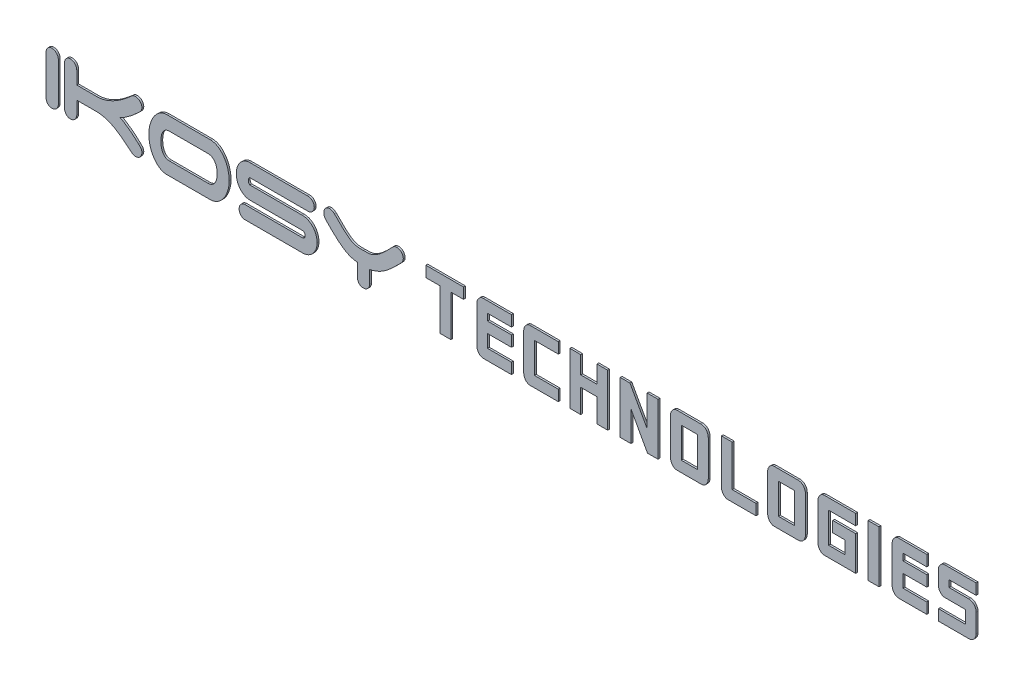
from build123d import *

# Parameters (mm, degrees)
TEXT_EXTRUDE_DEPTH    = 0.1
TEXT_EXTRUDE_2_DEPTH  = 0.1
TEXT_EXTRUDE_3_DEPTH  = 0.1
TEXT_EXTRUDE_4_DEPTH  = 0.1
TEXT_EXTRUDE_5_DEPTH  = 0.1
TEXT_EXTRUDE_6_DEPTH  = 0.1
TEXT_EXTRUDE_7_DEPTH  = 0.1
TEXT_EXTRUDE_8_DEPTH  = 0.1
TEXT_EXTRUDE_9_DEPTH  = 0.1
TEXT_EXTRUDE_10_DEPTH = 0.1
TEXT_SKETCH_W         = 0.872727273
TEXT_SKETCH_H         = 1.636363636
TEXT_EXTRUDE_11_DEPTH = 0.1
TEXT_EXTRUDE_12_DEPTH = 0.1
TEXT_SKETCH_W_2       = 0.872727272
TEXT_EXTRUDE_13_DEPTH = 0.1
TEXT_EXTRUDE_14_DEPTH = 0.1
TEXT_SKETCH_W_3       = 0.581818182
TEXT_SKETCH_H_2       = 2.8
TEXT_EXTRUDE_15_DEPTH = 0.1
TEXT_EXTRUDE_16_DEPTH = 0.1
TEXT_EXTRUDE_17_DEPTH = 0.1


with BuildPart() as part:
    # Text Sketch → Text Extrude (new body)
    with BuildSketch(Plane.XY):
        with BuildLine():
            add(Edge.make_bspline(
                [(0.770025924, 0.402981205), (0.769100464, 0.38197876), (0.767227902, 0.339482682), (0.747819923, 0.277513771), (0.717935584, 0.2173944), (0.678368994, 0.160054086), (0.626661606, 0.110313992), (0.562978058, 0.073883082), (0.488810615, 0.053108974), (0.436262188, 0.050488838), (0.408911212, 0.049125081)],
                knots=[0, 0, 0, 0, 0.891768742, 1.804393405, 2.73723021, 3.744576, 4.755535893, 5.764854616, 6.836627258, 8, 8, 8, 8], degree=3))
            add(Edge.make_bspline(
                [(0.408911212, 0.049125081), (0.38787013, 0.050203738), (0.346583857, 0.052320251), (0.288069812, 0.073334095), (0.235824177, 0.107352883), (0.190290246, 0.152672498), (0.152042241, 0.206458787), (0.125874933, 0.267854818), (0.108750946, 0.333700929), (0.106839806, 0.379583058), (0.105865198, 0.402981205)],
                knots=[0, 0, 0, 0, 0.9719281, 1.907092461, 2.840049136, 3.840945847, 4.867320657, 5.877591824, 6.917652236, 8, 8, 8, 8], degree=3))
            Line((0.105865198, 0.402981205), (0.105865198, 2.495268957))
            add(Edge.make_bspline(
                [(0.105865198, 2.495268957), (0.106806368, 2.518676155), (0.108640119, 2.56428213), (0.126065524, 2.629728186), (0.151970753, 2.690948813), (0.190627202, 2.744614247), (0.235577774, 2.791280862), (0.288659008, 2.82439188), (0.346792462, 2.846121687), (0.387843823, 2.848106489), (0.408911212, 2.849125081)],
                knots=[0, 0, 0, 0, 1.083042246, 2.110171353, 3.121090755, 4.148124132, 5.159529717, 6.104911255, 7.027448268, 8, 8, 8, 8], degree=3))
            add(Edge.make_bspline(
                [(0.408911212, 2.849125081), (0.436279932, 2.847806262), (0.48857148, 2.845286485), (0.562234552, 2.824094355), (0.626209705, 2.788085686), (0.676690967, 2.737031565), (0.718672215, 2.680937653), (0.747298742, 2.620189553), (0.767398885, 2.558538665), (0.769153021, 2.51629198), (0.770025924, 2.495268957)],
                knots=[0, 0, 0, 0, 1.164422676, 2.224783052, 3.235012677, 4.25579094, 5.261076507, 6.20633436, 7.107426445, 8, 8, 8, 8], degree=3))
            Line((0.770025924, 2.495268957), (0.770025924, 0.402981205))
        make_face()
    extrude(amount=TEXT_EXTRUDE_DEPTH)


with BuildPart() as body_2:
    # Text Sketch → Text Extrude 2 (new body)
    with BuildSketch(Plane.XY):
        with BuildLine():
            Line((1.763690214, 1.802981205), (2.827980557, 1.802981205))
            add(Edge.make_bspline(
                [(2.827980557, 1.802981205), (2.870657077, 1.804199673), (2.955944714, 1.806634741), (3.083232823, 1.820995082), (3.208884933, 1.847082013), (3.375712721, 1.893293848), (3.581242747, 1.973756548), (3.822298654, 2.093163456), (4.055077222, 2.236888499), (4.278204959, 2.398034905), (4.491821207, 2.56928233), (4.629652171, 2.687832831), (4.697974076, 2.746597537)],
                knots=[0, 0, 0, 0, 0.598390986, 1.195864919, 1.79291744, 2.395738573, 3.621030924, 4.880124848, 6.162898607, 7.451335977, 8.736643965, 10, 10, 10, 10], degree=3))
            add(Edge.make_bspline(
                [(4.697974076, 2.746597537), (4.715106529, 2.761926842), (4.747642249, 2.791038257), (4.800899855, 2.825038148), (4.856270743, 2.845150532), (4.893810991, 2.847822951), (4.912102398, 2.849125081)],
                knots=[0, 0, 0, 0, 1.132539444, 2.150771204, 3.098967176, 4, 4, 4, 4], degree=3))
            add(Edge.make_bspline(
                [(4.912102398, 2.849125081), (4.939480214, 2.847822491), (4.991789141, 2.845333721), (5.065587232, 2.823854142), (5.130190116, 2.788398085), (5.180771503, 2.736998815), (5.222775198, 2.680945804), (5.25139615, 2.620187546), (5.271497661, 2.558539151), (5.273251619, 2.516292141), (5.274124433, 2.495268957)],
                knots=[0, 0, 0, 0, 1.162794875, 2.221672924, 3.241673875, 4.261025145, 5.264905377, 6.208841809, 7.108674215, 8, 8, 8, 8], degree=3))
            add(Edge.make_bspline(
                [(5.274124433, 2.495268957), (5.271909873, 2.466737651), (5.267499542, 2.409917117), (5.229293815, 2.329927891), (5.171281497, 2.25593042), (5.123032849, 2.2114858), (5.097196371, 2.187686325)],
                knots=[0, 0, 0, 0, 0.930691466, 1.853486366, 2.850571857, 4, 4, 4, 4], degree=3))
            add(Edge.make_bspline(
                [(5.097196371, 2.187686325), (5.054627056, 2.148591015), (4.973562424, 2.074141921), (4.854319958, 1.966994095), (4.73594283, 1.86754386), (4.613852942, 1.770000128), (4.481596275, 1.674615553), (4.367758709, 1.595819699), (4.275168158, 1.53875346), (4.213015208, 1.500765845), (4.156371355, 1.471603622), (4.120379776, 1.455630408), (4.103677252, 1.448217758)],
                knots=[0, 0, 0, 0, 1.394680526, 2.655886419, 3.867820071, 5.124965461, 6.425567842, 7.801989833, 8.464170533, 9.049914496, 9.559096148, 10, 10, 10, 10], degree=3))
            add(Edge.make_bspline(
                [(4.103677252, 1.448217758), (4.122220662, 1.43994625), (4.161030335, 1.422634736), (4.220293441, 1.391245415), (4.283329446, 1.354418667), (4.371170374, 1.296747291), (4.482970734, 1.223246439), (4.611163243, 1.128009302), (4.735126151, 1.032852325), (4.852698401, 0.931021732), (4.973628723, 0.824530793), (5.054707125, 0.749751845), (5.097196371, 0.710563837)],
                knots=[0, 0, 0, 0, 0.490243261, 1.026034652, 1.618564429, 2.252714874, 3.56340164, 4.848998911, 6.108435473, 7.336408224, 8.604141129, 10, 10, 10, 10], degree=3))
            add(Edge.make_bspline(
                [(5.097196371, 0.710563837), (5.123634748, 0.685842427), (5.172330155, 0.64030941), (5.230449706, 0.566365026), (5.268868825, 0.487505583), (5.272348512, 0.431542815), (5.274124433, 0.402981205)],
                knots=[0, 0, 0, 0, 1.183672799, 2.180142437, 3.071202806, 4, 4, 4, 4], degree=3))
            add(Edge.make_bspline(
                [(5.274124433, 0.402981205), (5.273202889, 0.381975965), (5.271338248, 0.339474231), (5.251869344, 0.27754882), (5.222151445, 0.217097592), (5.181456291, 0.160341595), (5.129914401, 0.110270058), (5.066151734, 0.073895569), (4.992006736, 0.053105455), (4.939455063, 0.050487633), (4.912102398, 0.049125081)],
                knots=[0, 0, 0, 0, 0.890937897, 1.802712285, 2.734679982, 3.748540701, 4.758558701, 5.766937061, 6.837711151, 8, 8, 8, 8], degree=3))
            add(Edge.make_bspline(
                [(4.912102398, 0.049125081), (4.893445149, 0.050255128), (4.854978495, 0.052585006), (4.798987207, 0.075909014), (4.74263208, 0.109405827), (4.709220907, 0.140643357), (4.691622813, 0.157096565)],
                knots=[0, 0, 0, 0, 0.885578475, 1.825844712, 2.854844459, 4, 4, 4, 4], degree=3))
            add(Edge.make_bspline(
                [(4.691622813, 0.157096565), (4.623932405, 0.215592505), (4.48654833, 0.334315539), (4.272806227, 0.505291708), (4.051050671, 0.667091645), (3.85768285, 0.786050426), (3.699658135, 0.870329142), (3.579224674, 0.926638139), (3.456350596, 0.975469998), (3.332441566, 1.018319367), (3.207201551, 1.053430798), (3.080890108, 1.077293003), (2.95454637, 1.094039499), (2.870073751, 1.095465631), (2.827980557, 1.09617628)],
                knots=[0, 0, 0, 0, 1.509831065, 3.064344723, 4.618430907, 6.139977425, 6.891238491, 7.640276577, 8.382465372, 9.121787443, 9.852424025, 10.575208506, 11.29001819, 12, 12, 12, 12], degree=3))
            Line((2.827980557, 1.09617628), (1.763690214, 1.09617628))
            Line((1.763690214, 1.09617628), (1.763690214, 0.402981205))
            add(Edge.make_bspline(
                [(1.763690214, 0.402981205), (1.762768593, 0.381976068), (1.760903796, 0.339474542), (1.741436088, 0.277547528), (1.711713391, 0.21710274), (1.671037755, 0.160320538), (1.619611699, 0.110531595), (1.557178236, 0.074277219), (1.484982519, 0.052942734), (1.43387676, 0.050437237), (1.407112119, 0.049125081)],
                knots=[0, 0, 0, 0, 0.899232803, 1.819496092, 2.760140696, 3.78344077, 4.80286235, 5.809387238, 6.85275233, 8, 8, 8, 8], degree=3))
            add(Edge.make_bspline(
                [(1.407112119, 0.049125081), (1.386071037, 0.050203738), (1.344784764, 0.052320251), (1.28627072, 0.073334095), (1.234025084, 0.107352883), (1.188491154, 0.152672498), (1.150243149, 0.206458787), (1.12407584, 0.267854818), (1.106951853, 0.333700929), (1.105040714, 0.379583058), (1.104066105, 0.402981205)],
                knots=[0, 0, 0, 0, 0.9719281, 1.907092461, 2.840049136, 3.840945847, 4.867320657, 5.877591824, 6.917652236, 8, 8, 8, 8], degree=3))
            Line((1.104066105, 0.402981205), (1.104066105, 2.495268957))
            add(Edge.make_bspline(
                [(1.104066105, 2.495268957), (1.105007602, 2.518675656), (1.106841991, 2.564280659), (1.124262827, 2.629733683), (1.150185052, 2.690928392), (1.18877752, 2.744691389), (1.233601878, 2.790639584), (1.285112724, 2.824653513), (1.341706068, 2.845858413), (1.381526624, 2.848027792), (1.401668179, 2.849125081)],
                knots=[0, 0, 0, 0, 1.093794082, 2.131119951, 3.152075194, 4.189304383, 5.210750635, 6.141692323, 7.060053139, 8, 8, 8, 8], degree=3))
            add(Edge.make_bspline(
                [(1.401668179, 2.849125081), (1.429045995, 2.847822491), (1.481354922, 2.845333721), (1.555153013, 2.823854142), (1.619755897, 2.788398085), (1.670337284, 2.736998815), (1.712340979, 2.680945804), (1.740961931, 2.620187546), (1.761063442, 2.558539151), (1.7628174, 2.516292141), (1.763690214, 2.495268957)],
                knots=[0, 0, 0, 0, 1.162794875, 2.221672924, 3.241673875, 4.261025145, 5.264905377, 6.208841809, 7.108674215, 8, 8, 8, 8], degree=3))
            Line((1.763690214, 2.495268957), (1.763690214, 1.802981205))
        make_face()
    extrude(amount=TEXT_EXTRUDE_2_DEPTH)


with BuildPart() as body_3:
    # Text Sketch → Text Extrude 3 (new body)
    with BuildSketch(Plane.XY):
        with BuildLine():
            add(Edge.make_bspline(
                [(9.977834089, 1.449125081), (9.976768994, 1.410693114), (9.974609055, 1.332755732), (9.962971788, 1.215011152), (9.941470153, 1.095428473), (9.912817637, 0.975434572), (9.87719651, 0.856860297), (9.83244172, 0.743285713), (9.780589543, 0.635049574), (9.721917238, 0.531794432), (9.653621978, 0.43566543), (9.576838076, 0.345708882), (9.490544852, 0.263320687), (9.395840144, 0.188502711), (9.291422378, 0.125804716), (9.176256373, 0.080890731), (9.051758956, 0.054299041), (8.965693599, 0.050874965), (8.921709657, 0.049125081)],
                knots=[0, 0, 0, 0, 0.951147274, 1.928861125, 2.924201554, 3.955194829, 4.980222808, 5.984971413, 6.972403223, 7.947966706, 8.919705167, 9.885634216, 10.870112358, 11.867111244, 12.866914791, 13.871663396, 14.912307617, 16, 16, 16, 16], degree=3))
            Line((8.921709657, 0.049125081), (6.589888529, 0.049125081))
            add(Edge.make_bspline(
                [(6.589888529, 0.049125081), (6.552500658, 0.052855716), (6.479131709, 0.060176615), (6.373238223, 0.090109028), (6.274157022, 0.134652098), (6.183449888, 0.195498039), (6.10038554, 0.267754573), (6.023221857, 0.34782968), (5.951884602, 0.435130995), (5.8885166, 0.530774813), (5.832472362, 0.633249702), (5.783805796, 0.74151249), (5.740735087, 0.854325028), (5.705556648, 0.971682517), (5.678980286, 1.091606827), (5.658673805, 1.211466461), (5.646414023, 1.330612003), (5.645107074, 1.409780238), (5.64445755, 1.449125081)],
                knots=[0, 0, 0, 0, 0.975181915, 1.913670687, 2.84608033, 3.788086209, 4.741473597, 5.703381033, 6.675865344, 7.668013681, 8.681367061, 9.708774433, 10.751351276, 11.818422699, 12.890348938, 13.9424572, 14.977447237, 16, 16, 16, 16], degree=3))
            add(Edge.make_bspline(
                [(5.64445755, 1.449125081), (5.645495707, 1.489674778), (5.647576169, 1.570936218), (5.659338805, 1.693199019), (5.680567048, 1.815551665), (5.709183039, 1.937515995), (5.746498326, 2.056836595), (5.790228883, 2.171801317), (5.842869418, 2.280618605), (5.901159881, 2.384122363), (5.968046634, 2.48061485), (6.044007117, 2.567646161), (6.126086355, 2.647467166), (6.215238893, 2.718375165), (6.312221834, 2.777211779), (6.416601715, 2.819261995), (6.527577539, 2.844715931), (6.603664886, 2.847634784), (6.642513286, 2.849125081)],
                knots=[0, 0, 0, 0, 1.027412279, 2.058930345, 3.10819438, 4.171215559, 5.230253093, 6.273232037, 7.284199589, 8.289664721, 9.280159167, 10.252499264, 11.211587296, 12.177263302, 13.132548821, 14.074435823, 15.016852456, 16, 16, 16, 16], degree=3))
            Line((6.642513286, 2.849125081), (8.975241737, 2.848217758))
            add(Edge.make_bspline(
                [(8.975241737, 2.848217758), (9.018088978, 2.844358502), (9.101553319, 2.836840859), (9.22091963, 2.804313656), (9.330210435, 2.756006869), (9.428627689, 2.691520227), (9.516522346, 2.615509198), (9.59823537, 2.534085314), (9.670026252, 2.444056529), (9.734355269, 2.348140785), (9.790715807, 2.245953078), (9.839530262, 2.138360871), (9.882543536, 2.026188691), (9.916361269, 1.909447309), (9.943190646, 1.791820676), (9.963459914, 1.675591853), (9.975862664, 1.561603885), (9.977181559, 1.486354907), (9.977834089, 1.449125081)],
                knots=[0, 0, 0, 0, 1.091442399, 2.126076716, 3.127202836, 4.1162807, 5.103236494, 6.075967326, 7.043340396, 8.023812075, 9.007621206, 10.004905352, 11.024010646, 12.057502667, 13.090308704, 14.088421602, 15.054236585, 16, 16, 16, 16], degree=3))
        make_face()
        with BuildLine():
            add(Edge.make_bspline(
                [(8.813738172, 0.755930006), (8.838912426, 0.756747149), (8.886888002, 0.758304409), (8.955180633, 0.771516297), (9.016797932, 0.791434255), (9.08660697, 0.83260366), (9.161351282, 0.89657875), (9.230746739, 0.991778059), (9.279799102, 1.10145625), (9.308259352, 1.220132072), (9.324261497, 1.337078989), (9.326937626, 1.413395263), (9.328190538, 1.449125081)],
                knots=[0, 0, 0, 0, 0.775634069, 1.478156669, 2.138937624, 2.761407784, 3.965416657, 5.146404436, 6.36538836, 7.645919842, 8.897864736, 10, 10, 10, 10], degree=3))
            add(Edge.make_bspline(
                [(9.328190538, 1.449125081), (9.326940513, 1.484856276), (9.324270552, 1.561175491), (9.308216911, 1.678097852), (9.280022246, 1.79660109), (9.230445434, 1.905711034), (9.161363829, 2.001078623), (9.085874058, 2.064682084), (9.015723794, 2.105705074), (8.954475669, 2.12701859), (8.88624899, 2.139801106), (8.838598359, 2.141456504), (8.813738172, 2.142320156)],
                knots=[0, 0, 0, 0, 1.102975105, 2.355873999, 3.637381263, 4.848799325, 6.030687032, 7.242716405, 7.865660895, 8.530035044, 9.233092976, 10, 10, 10, 10], degree=3))
            Line((8.813738172, 2.142320156), (6.749577447, 2.142320156))
            add(Edge.make_bspline(
                [(6.749577447, 2.142320156), (6.729259059, 2.141685861), (6.690120803, 2.140464051), (6.63415291, 2.129383852), (6.583434803, 2.111379464), (6.523622383, 2.076708438), (6.457481335, 2.016381646), (6.394321307, 1.923909103), (6.343853297, 1.814200448), (6.313746735, 1.692157678), (6.296764897, 1.569082951), (6.294347675, 1.487885768), (6.293193778, 1.449125081)],
                knots=[0, 0, 0, 0, 0.656485055, 1.26455312, 1.836963808, 2.388955021, 3.490378164, 4.697909542, 5.989021309, 7.374490996, 8.746674077, 10, 10, 10, 10], degree=3))
            add(Edge.make_bspline(
                [(6.293193778, 1.449125081), (6.294331154, 1.41036199), (6.296713767, 1.329159771), (6.313964449, 1.206200956), (6.343040805, 1.083806782), (6.392721388, 0.973350736), (6.458188795, 0.882073848), (6.523389634, 0.820787026), (6.583269628, 0.785755928), (6.634355384, 0.769148338), (6.690091911, 0.757701387), (6.729249186, 0.756535348), (6.749577447, 0.755930006)],
                knots=[0, 0, 0, 0, 1.252397314, 2.623563721, 4.005555294, 5.304601695, 6.508940413, 7.616080884, 8.167663118, 8.736383808, 9.344001345, 10, 10, 10, 10], degree=3))
            Line((6.749577447, 0.755930006), (8.813738172, 0.755930006))
        make_face(mode=Mode.SUBTRACT)
    extrude(amount=TEXT_EXTRUDE_3_DEPTH)


with BuildPart() as body_4:
    # Text Sketch → Text Extrude 4 (new body)
    with BuildSketch(Plane.XY):
        with BuildLine():
            add(Edge.make_bspline(
                [(11.096709008, 1.09617628), (11.070628979, 1.096985745), (11.019311932, 1.09857851), (10.944209415, 1.113085503), (10.871789321, 1.134515488), (10.803063834, 1.16590159), (10.737747301, 1.203569096), (10.677691213, 1.248941867), (10.620944537, 1.298711625), (10.569259265, 1.355005558), (10.523229084, 1.417176508), (10.480900088, 1.483510377), (10.445148969, 1.555212288), (10.413869019, 1.630810659), (10.389149182, 1.710927181), (10.372599134, 1.795206955), (10.36095904, 1.882808223), (10.359696863, 1.942367025), (10.359055087, 1.97265068)],
                knots=[0, 0, 0, 0, 0.983596924, 1.935399995, 2.878119717, 3.828757832, 4.780492416, 5.719054283, 6.665362703, 7.626977031, 8.597497885, 9.582684033, 10.593731797, 11.61784737, 12.668851806, 13.752649796, 14.857297694, 16, 16, 16, 16], degree=3))
            add(Edge.make_bspline(
                [(10.359055087, 1.97265068), (10.359683542, 2.002936111), (10.360913292, 2.06219815), (10.372613648, 2.149185761), (10.389094597, 2.232596245), (10.41414614, 2.311960919), (10.444833549, 2.387692173), (10.48223479, 2.458471572), (10.52287105, 2.52605734), (10.570599551, 2.587300335), (10.62175593, 2.644787317), (10.678348818, 2.695436022), (10.738647593, 2.740864498), (10.804199369, 2.778285022), (10.872456751, 2.811015093), (10.945148926, 2.832145217), (11.019913115, 2.846682529), (11.070930108, 2.848305163), (11.096709008, 2.849125081)],
                knots=[0, 0, 0, 0, 1.143988435, 2.238538075, 3.312358927, 4.353623736, 5.378891967, 6.396292345, 7.376541077, 8.355055443, 9.326197841, 10.281195237, 11.22081347, 12.173619245, 13.130052163, 14.07383293, 15.02670727, 16, 16, 16, 16], degree=3))
            Line((11.096709008, 2.849125081), (14.197940376, 2.849125081))
            add(Edge.make_bspline(
                [(14.197940376, 2.849125081), (14.225318192, 2.847822491), (14.277627119, 2.845333721), (14.35142521, 2.823854142), (14.416028094, 2.788398085), (14.466609481, 2.736998815), (14.508613176, 2.680945804), (14.537234128, 2.620187546), (14.557335639, 2.558539151), (14.559089597, 2.516292141), (14.559962411, 2.495268957)],
                knots=[0, 0, 0, 0, 1.162794875, 2.221672924, 3.241673875, 4.261025145, 5.264905377, 6.208841809, 7.108674215, 8, 8, 8, 8], degree=3))
            add(Edge.make_bspline(
                [(14.559962411, 2.495268957), (14.55908865, 2.474246844), (14.557332788, 2.432001987), (14.537245896, 2.370337057), (14.508565383, 2.309646164), (14.466926676, 2.253490744), (14.415803347, 2.203431399), (14.351975225, 2.167100231), (14.277848797, 2.146297827), (14.225294439, 2.143681783), (14.197940376, 2.142320156)],
                knots=[0, 0, 0, 0, 0.892186174, 1.792887181, 2.737734788, 3.742584057, 4.754017175, 5.763808356, 6.836082689, 8, 8, 8, 8], degree=3))
            Line((14.197940376, 2.142320156), (11.085821128, 2.142320156))
            add(Edge.make_bspline(
                [(11.085821128, 2.142320156), (11.080881315, 2.139118825), (11.064606541, 2.128571677), (11.045471723, 2.107020748), (11.025860023, 2.080289984), (11.015692428, 2.049772452), (11.00807166, 2.013564784), (11.007889094, 1.986920718), (11.007791316, 1.97265068)],
                knots=[0, 0, 0, 0, 0.538815641, 1.775189386, 2.614152017, 3.562550695, 4.694550051, 6, 6, 6, 6], degree=3))
            add(Edge.make_bspline(
                [(11.007791316, 1.97265068), (11.007902671, 1.958987286), (11.008112447, 1.933247638), (11.015777271, 1.89794097), (11.026094047, 1.867596333), (11.045544192, 1.839663911), (11.064990168, 1.817538744), (11.081202387, 1.806208973), (11.085821128, 1.802981205)],
                knots=[0, 0, 0, 0, 1.254786338, 2.363816585, 3.315845588, 4.181196817, 5.481836512, 6, 6, 6, 6], degree=3))
            Line((11.085821128, 1.802981205), (13.912133506, 1.802981205))
            add(Edge.make_bspline(
                [(13.912133506, 1.802981205), (13.942161921, 1.802341305), (14.0011278, 1.801084751), (14.087355454, 1.78420387), (14.17047029, 1.760767806), (14.248278281, 1.724371845), (14.321036634, 1.681886546), (14.389177054, 1.635122069), (14.448812276, 1.580867085), (14.502947909, 1.522827162), (14.549655459, 1.459367173), (14.593338255, 1.393666562), (14.628106209, 1.321700073), (14.659125116, 1.247095258), (14.683804021, 1.168840514), (14.700913798, 1.088017276), (14.711053732, 1.004794724), (14.712544805, 0.948612856), (14.713300065, 0.920155541)],
                knots=[0, 0, 0, 0, 1.085808164, 2.132168238, 3.171913903, 4.206279592, 5.232083903, 6.222782105, 7.192487131, 8.145971036, 9.092381708, 10.043408583, 10.998652613, 11.981141727, 12.968503725, 13.965359516, 14.969411183, 16, 16, 16, 16], degree=3))
            add(Edge.make_bspline(
                [(14.713300065, 0.920155541), (14.712561995, 0.891695999), (14.711112648, 0.835810012), (14.700804814, 0.752915315), (14.683933323, 0.672641537), (14.659254903, 0.595269996), (14.627943024, 0.521516894), (14.592113403, 0.450811094), (14.549689794, 0.383846582), (14.502107833, 0.320703426), (14.448221539, 0.26178399), (14.387398957, 0.209446568), (14.320397163, 0.162855444), (14.248193385, 0.121881619), (14.170375682, 0.088989236), (14.087569143, 0.066811425), (14.001326436, 0.051319432), (13.94214588, 0.049863454), (13.912133506, 0.049125081)],
                knots=[0, 0, 0, 0, 1.035936791, 2.03426853, 3.036297246, 4.018283363, 4.985529056, 5.95070443, 6.900751025, 7.867495229, 8.825926993, 9.801658554, 10.782162054, 11.792804442, 12.819336256, 13.847814886, 14.908557315, 16, 16, 16, 16], degree=3))
            Line((13.912133506, 0.049125081), (10.815438756, 0.049125081))
            add(Edge.make_bspline(
                [(10.815438756, 0.049125081), (10.794397674, 0.050203738), (10.753111401, 0.052320251), (10.694597356, 0.073334095), (10.64235172, 0.107352883), (10.59681779, 0.152672498), (10.558569785, 0.206458787), (10.532402476, 0.267854818), (10.51527849, 0.333700929), (10.51336735, 0.379583058), (10.512392741, 0.402981205)],
                knots=[0, 0, 0, 0, 0.9719281, 1.907092461, 2.840049136, 3.840945847, 4.867320657, 5.877591824, 6.917652236, 8, 8, 8, 8], degree=3))
            add(Edge.make_bspline(
                [(10.512392741, 0.402981205), (10.513335077, 0.426387231), (10.515171098, 0.471990922), (10.532580234, 0.537453352), (10.558545977, 0.598613074), (10.596850283, 0.652333395), (10.642432552, 0.698053934), (10.695149829, 0.731233522), (10.75332967, 0.75291695), (10.794374644, 0.754908137), (10.815438756, 0.755930006)],
                knots=[0, 0, 0, 0, 1.084379646, 2.112777108, 3.124944849, 4.153246463, 5.156022148, 6.102571096, 7.026247308, 8, 8, 8, 8], degree=3))
            Line((10.815438756, 0.755930006), (13.932094621, 0.755930006))
            add(Edge.make_bspline(
                [(13.932094621, 0.755930006), (13.948731069, 0.758443829), (13.983793179, 0.76374183), (14.026735913, 0.802257485), (14.058828082, 0.855380166), (14.062018527, 0.898181283), (14.063656513, 0.920155541)],
                knots=[0, 0, 0, 0, 0.856172035, 1.804423513, 2.872782579, 4, 4, 4, 4], degree=3))
            add(Edge.make_bspline(
                [(14.063656513, 0.920155541), (14.062252652, 0.944028262), (14.059563776, 0.98975269), (14.025725357, 1.04548982), (13.983903402, 1.087290119), (13.948499257, 1.093362583), (13.932094621, 1.09617628)],
                knots=[0, 0, 0, 0, 1.173177926, 2.247037123, 3.187758464, 4, 4, 4, 4], degree=3))
            Line((13.932094621, 1.09617628), (11.096709008, 1.09617628))
        make_face()
    extrude(amount=TEXT_EXTRUDE_4_DEPTH)


with BuildPart() as body_5:
    # Text Sketch → Text Extrude 5 (new body)
    with BuildSketch(Plane.XY):
        with BuildLine():
            add(Edge.make_bspline(
                [(17.547016202, 0.402981205), (17.546094663, 0.381975944), (17.544230034, 0.339474167), (17.524761043, 0.277549084), (17.495043494, 0.217096542), (17.454346913, 0.16034589), (17.40281042, 0.110254151), (17.339282394, 0.074101564), (17.265545389, 0.052979101), (17.213264587, 0.050449199), (17.185901491, 0.049125081)],
                knots=[0, 0, 0, 0, 0.892316173, 1.805501072, 2.738910519, 3.754339675, 4.765920168, 5.775858484, 6.835913096, 8, 8, 8, 8], degree=3))
            add(Edge.make_bspline(
                [(17.185901491, 0.049125081), (17.164851326, 0.05018937), (17.123547232, 0.052277691), (17.064919912, 0.073584989), (17.011997077, 0.107025373), (16.966399134, 0.152713882), (16.928118307, 0.206447792), (16.901959771, 0.267857822), (16.884833402, 0.333700133), (16.882922593, 0.379582789), (16.881948153, 0.402981205)],
                knots=[0, 0, 0, 0, 0.970494358, 1.904279209, 2.84766085, 3.847081086, 4.871941837, 5.8807227, 6.919248864, 8, 8, 8, 8], degree=3))
            Line((16.881948153, 0.402981205), (16.881948153, 1.09617628))
            add(Edge.make_bspline(
                [(16.881948153, 1.09617628), (16.856483778, 1.096760737), (16.803439275, 1.097978212), (16.721552028, 1.112637334), (16.633246237, 1.130647644), (16.540450088, 1.159609538), (16.443333885, 1.194847007), (16.345627602, 1.242719281), (16.244154442, 1.295493748), (16.141900633, 1.359643591), (16.037250175, 1.432852441), (15.929369087, 1.51440759), (15.818698093, 1.60532902), (15.704606587, 1.706112617), (15.58508882, 1.817440449), (15.459361496, 1.941288818), (15.324676915, 2.076413974), (15.233468698, 2.17178839), (15.186160726, 2.221257291)],
                knots=[0, 0, 0, 0, 0.585611842, 1.219880273, 1.911005649, 2.660046327, 3.455522801, 4.28723795, 5.162614187, 6.08825972, 7.063796296, 8.102785557, 9.201282419, 10.360792427, 11.607368717, 12.961567007, 14.42402243, 16, 16, 16, 16], degree=3))
            add(Edge.make_bspline(
                [(15.186160726, 2.221257291), (15.170990142, 2.23925089), (15.139550626, 2.276540824), (15.104175315, 2.342858267), (15.078177914, 2.416621346), (15.075161862, 2.469039043), (15.073652625, 2.495268957)],
                knots=[0, 0, 0, 0, 0.930533267, 1.928437027, 2.963386003, 4, 4, 4, 4], degree=3))
            add(Edge.make_bspline(
                [(15.073652625, 2.495268957), (15.074593795, 2.518676155), (15.076427546, 2.56428213), (15.093852952, 2.629728186), (15.11975818, 2.690948813), (15.15841463, 2.744614247), (15.203365201, 2.791280862), (15.256446435, 2.82439188), (15.314579889, 2.846121687), (15.35563125, 2.848106489), (15.376698639, 2.849125081)],
                knots=[0, 0, 0, 0, 1.083042246, 2.110171353, 3.121090755, 4.148124132, 5.159529717, 6.104911255, 7.027448268, 8, 8, 8, 8], degree=3))
            add(Edge.make_bspline(
                [(15.376698639, 2.849125081), (15.404811972, 2.848454461), (15.455657957, 2.847241572), (15.525278178, 2.820596621), (15.585020783, 2.778798972), (15.624561984, 2.748004252), (15.646173688, 2.73117304)],
                knots=[0, 0, 0, 0, 1.109975967, 2.007510903, 2.910981876, 4, 4, 4, 4], degree=3))
            add(Edge.make_bspline(
                [(15.646173688, 2.73117304), (15.698607352, 2.676547975), (15.797839486, 2.573168556), (15.941761902, 2.429105358), (16.071683345, 2.304309024), (16.188861717, 2.197168269), (16.295976213, 2.108009511), (16.392631845, 2.031357598), (16.482845603, 1.971107796), (16.564382515, 1.920915303), (16.642545265, 1.884554589), (16.716819033, 1.854808232), (16.789570582, 1.834077913), (16.861537736, 1.819948408), (16.93565795, 1.812322272), (17.014660579, 1.80713735), (17.100271922, 1.803176082), (17.159584196, 1.80304789), (17.190438108, 1.802981205)],
                knots=[0, 0, 0, 0, 1.940989791, 3.673375928, 5.21971598, 6.558997957, 7.742271975, 8.792173579, 9.71897935, 10.522084621, 11.243410044, 11.925854674, 12.57122337, 13.179430296, 13.80358698, 14.479704554, 15.20915084, 16, 16, 16, 16], degree=3))
            add(Edge.make_bspline(
                [(17.190438108, 1.802981205), (17.222503225, 1.80302739), (17.284539054, 1.803116742), (17.373737984, 1.807387585), (17.45610087, 1.811335813), (17.533128902, 1.818430045), (17.608927686, 1.830581872), (17.685082046, 1.854428841), (17.764454066, 1.88515555), (17.847138981, 1.926103304), (17.935205816, 1.977254863), (18.028343353, 2.042686365), (18.129375476, 2.119899697), (18.237851067, 2.211898966), (18.356965885, 2.31878177), (18.48616554, 2.444682686), (18.628726512, 2.587970976), (18.726735499, 2.690754564), (18.778254051, 2.74478289)],
                knots=[0, 0, 0, 0, 0.801275837, 1.550214502, 2.231561805, 2.861855512, 3.483201953, 4.145671226, 4.851727918, 5.608974258, 6.449063644, 7.394677935, 8.451460899, 9.626397165, 10.948421642, 12.450584152, 14.134244952, 16, 16, 16, 16], degree=3))
            add(Edge.make_bspline(
                [(18.778254051, 2.74478289), (18.795264995, 2.760611098), (18.827819558, 2.790902208), (18.882697448, 2.823116339), (18.937750193, 2.845712808), (18.975540217, 2.847997257), (18.994197019, 2.849125081)],
                knots=[0, 0, 0, 0, 1.130631575, 2.163737455, 3.09344365, 4, 4, 4, 4], degree=3))
            add(Edge.make_bspline(
                [(18.994197019, 2.849125081), (19.021574835, 2.847822491), (19.073883762, 2.845333721), (19.147681853, 2.823854142), (19.212284737, 2.788398085), (19.262866124, 2.736998815), (19.304869819, 2.680945804), (19.33349077, 2.620187546), (19.353592282, 2.558539151), (19.35534624, 2.516292141), (19.356219054, 2.495268957)],
                knots=[0, 0, 0, 0, 1.162794875, 2.221672924, 3.241673875, 4.261025145, 5.264905377, 6.208841809, 7.108674215, 8, 8, 8, 8], degree=3))
            add(Edge.make_bspline(
                [(19.356219054, 2.495268957), (19.354895238, 2.472381359), (19.352178218, 2.425406524), (19.32631052, 2.35608197), (19.285385319, 2.285951277), (19.247049921, 2.243854487), (19.226471808, 2.221257291)],
                knots=[0, 0, 0, 0, 0.880816046, 1.807799517, 2.823245602, 4, 4, 4, 4], degree=3))
            add(Edge.make_bspline(
                [(19.226471808, 2.221257291), (19.142422568, 2.134731725), (18.979356891, 1.966861676), (18.77030293, 1.769471914), (18.607311984, 1.626705385), (18.490393541, 1.531396784), (18.376857031, 1.446672835), (18.26648527, 1.371160117), (18.157701952, 1.306601912), (18.050810939, 1.249871589), (17.944275132, 1.202588957), (17.841284166, 1.164628091), (17.746941128, 1.135084756), (17.666325921, 1.114383099), (17.601626267, 1.100088074), (17.563393864, 1.097349435), (17.547016202, 1.09617628)],
                knots=[0, 0, 0, 0, 2.457848734, 4.768523401, 5.856136151, 6.87253596, 7.841335827, 8.742142452, 9.596133573, 10.417618115, 11.206676869, 11.969101275, 12.653286335, 13.219797505, 13.665783694, 14, 14, 14, 14], degree=3))
            Line((17.547016202, 1.09617628), (17.547016202, 0.402981205))
        make_face()
    extrude(amount=TEXT_EXTRUDE_5_DEPTH)


with BuildPart() as body_6:
    # Text Sketch → Text Extrude 6 (new body)
    with BuildSketch(Plane.XY):
        Polygon((22.598295453, 2.217931511), (21.918181817, 2.217931511), (21.918181817, -0.000250307), (21.336363635, -0.000250307), (21.336363635, 2.217931511), (20.572727271, 2.217931511), (20.572727271, 2.799749693), (22.598295453, 2.799749693), align=None)
    extrude(amount=TEXT_EXTRUDE_6_DEPTH)


with BuildPart() as body_7:
    # Text Sketch → Text Extrude 7 (new body)
    with BuildSketch(Plane.XY):
        with BuildLine():
            Line((25.183727271, -0.000250307), (23.673499998, -0.000250307))
            add(Edge.make_bspline(
                [(23.673499998, -0.000250307), (23.661343485, -3.7947e-05), (23.637239554, 0.000383121), (23.602103293, 0.007232798), (23.568050234, 0.016396763), (23.536081745, 0.031395253), (23.504693315, 0.048626898), (23.475009803, 0.070496618), (23.447042404, 0.0964188), (23.411697496, 0.135590301), (23.373718436, 0.190640935), (23.341994289, 0.264318579), (23.32081831, 0.343080506), (23.318832004, 0.397903871), (23.31781818, 0.425886056)],
                knots=[0, 0, 0, 0, 0.709741819, 1.407275866, 2.087441194, 2.766794169, 3.466172966, 4.179622385, 4.916591893, 5.693048513, 7.263132824, 8.800679545, 10.367047027, 12, 12, 12, 12], degree=3))
            Line((23.31781818, 0.425886056), (23.31781818, 2.373613329))
            add(Edge.make_bspline(
                [(23.31781818, 2.373613329), (23.318855813, 2.401584534), (23.320888767, 2.456386385), (23.341703245, 2.535210433), (23.374620614, 2.608230303), (23.412165778, 2.66343033), (23.447817119, 2.702479043), (23.475360432, 2.729059719), (23.505211024, 2.750642011), (23.536292582, 2.768427537), (23.56850152, 2.782955225), (23.602482184, 2.79221841), (23.637422849, 2.799154797), (23.661342313, 2.799549218), (23.673499998, 2.799749693)],
                knots=[0, 0, 0, 0, 1.634105351, 3.201578221, 4.734609129, 6.305801451, 7.082806018, 7.827838545, 8.541791447, 9.232028214, 9.921997879, 10.602643201, 11.289757315, 12, 12, 12, 12], degree=3))
            Line((23.673499998, 2.799749693), (25.183727271, 2.799749693))
            Line((25.183727271, 2.799749693), (25.183727271, 2.217931511))
            Line((25.183727271, 2.217931511), (23.899636362, 2.217931511))
            Line((23.899636362, 2.217931511), (23.899636362, 1.854295147))
            Line((23.899636362, 1.854295147), (25.183727271, 1.854295147))
            Line((25.183727271, 1.854295147), (25.183727271, 1.272476966))
            Line((25.183727271, 1.272476966), (23.899636362, 1.272476966))
            Line((23.899636362, 1.272476966), (23.899636362, 0.581567875))
            Line((23.899636362, 0.581567875), (25.183727271, 0.581567875))
            Line((25.183727271, 0.581567875), (25.183727271, -0.000250307))
        make_face()
    extrude(amount=TEXT_EXTRUDE_7_DEPTH)


with BuildPart() as body_8:
    # Text Sketch → Text Extrude 8 (new body)
    with BuildSketch(Plane.XY):
        with BuildLine():
            Line((27.710636362, -0.000250307), (26.200409089, -0.000250307))
            add(Edge.make_bspline(
                [(26.200409089, -0.000250307), (26.188252576, -3.7947e-05), (26.164148645, 0.000383121), (26.129012384, 0.007232798), (26.094959325, 0.016396763), (26.062990836, 0.031395253), (26.031602405, 0.048626898), (26.001918894, 0.070496618), (25.973951495, 0.0964188), (25.938606587, 0.135590301), (25.900627527, 0.190640935), (25.86890338, 0.264318579), (25.847727401, 0.343080506), (25.845741094, 0.397903871), (25.844727271, 0.425886056)],
                knots=[0, 0, 0, 0, 0.709741819, 1.407275866, 2.087441194, 2.766794169, 3.466172966, 4.179622385, 4.916591893, 5.693048513, 7.263132824, 8.800679545, 10.367047027, 12, 12, 12, 12], degree=3))
            Line((25.844727271, 0.425886056), (25.844727271, 2.373613329))
            add(Edge.make_bspline(
                [(25.844727271, 2.373613329), (25.845764904, 2.401584534), (25.847797858, 2.456386385), (25.868612336, 2.535210433), (25.901529704, 2.608230303), (25.939074869, 2.66343033), (25.974726209, 2.702479043), (26.002269523, 2.729059719), (26.032120114, 2.750642011), (26.063201673, 2.768427537), (26.095410611, 2.782955225), (26.129391275, 2.79221841), (26.16433194, 2.799154797), (26.188251404, 2.799549218), (26.200409089, 2.799749693)],
                knots=[0, 0, 0, 0, 1.634105351, 3.201578221, 4.734609129, 6.305801451, 7.082806018, 7.827838545, 8.541791447, 9.232028214, 9.921997879, 10.602643201, 11.289757315, 12, 12, 12, 12], degree=3))
            Line((26.200409089, 2.799749693), (27.710636362, 2.799749693))
            Line((27.710636362, 2.799749693), (27.710636362, 2.217931511))
            Line((27.710636362, 2.217931511), (26.426545453, 2.217931511))
            Line((26.426545453, 2.217931511), (26.426545453, 0.581567875))
            Line((26.426545453, 0.581567875), (27.710636362, 0.581567875))
            Line((27.710636362, 0.581567875), (27.710636362, -0.000250307))
        make_face()
    extrude(amount=TEXT_EXTRUDE_8_DEPTH)


with BuildPart() as body_9:
    # Text Sketch → Text Extrude 9 (new body)
    with BuildSketch(Plane.XY):
        Polygon((30.371636362, -0.000250307), (29.78981818, -0.000250307), (29.78981818, 1.272476966), (28.917090908, 1.272476966), (28.917090908, -0.000250307), (28.335272726, -0.000250307), (28.335272726, 2.799749693), (28.917090908, 2.799749693), (28.917090908, 1.854295147), (29.78981818, 1.854295147), (29.78981818, 2.799749693), (30.371636362, 2.799749693), align=None)
    extrude(amount=TEXT_EXTRUDE_9_DEPTH)


with BuildPart() as body_10:
    # Text Sketch → Text Extrude 10 (new body)
    with BuildSketch(Plane.XY):
        Polygon((33.080363635, -0.000250307), (32.513886362, -0.000250307), (31.62581818, 1.618499693), (31.62581818, -0.000250307), (31.043999998, -0.000250307), (31.043999998, 2.799749693), (31.56956818, 2.799749693), (32.483204544, 1.153158784), (32.499113635, 2.799749693), (33.080363635, 2.799749693), align=None)
    extrude(amount=TEXT_EXTRUDE_10_DEPTH)


with BuildPart() as body_11:
    # Text Sketch → Text Extrude 11 (new body)
    with BuildSketch(Plane.XY):
        with BuildLine():
            add(Edge.make_bspline(
                [(35.789090908, 0.425886056), (35.787847817, 0.399226346), (35.785394302, 0.346607466), (35.763570725, 0.269884065), (35.729308486, 0.197153775), (35.689721637, 0.141209095), (35.652428974, 0.100790077), (35.622147861, 0.073703586), (35.589527127, 0.050854936), (35.55490001, 0.031987802), (35.517997154, 0.017692407), (35.479117087, 0.007497547), (35.437973876, 0.001102381), (35.409758373, 0.00020714), (35.395340908, -0.000250307)],
                knots=[0, 0, 0, 0, 1.485777301, 2.932512574, 4.417725377, 5.957928984, 6.736100761, 7.485134666, 8.221447279, 8.954792871, 9.681322195, 10.425113323, 11.195269569, 12, 12, 12, 12], degree=3))
            Line((35.395340908, -0.000250307), (34.110113635, -0.000250307))
            add(Edge.make_bspline(
                [(34.110113635, -0.000250307), (34.097955588, -4.3221e-05), (34.073848617, 0.00036739), (34.038555499, 0.007329164), (34.004246893, 0.016271555), (33.972136692, 0.031414535), (33.940714292, 0.048597339), (33.911033713, 0.070682263), (33.882523451, 0.096212369), (33.847207843, 0.135641924), (33.809318053, 0.190766688), (33.776755664, 0.264172246), (33.755771735, 0.343099383), (33.753756076, 0.39791025), (33.752727271, 0.425886056)],
                knots=[0, 0, 0, 0, 0.708363426, 1.404542787, 2.094017782, 2.772051382, 3.470071911, 4.182135736, 4.925854674, 5.700803332, 7.267838374, 8.806892964, 10.370218394, 12, 12, 12, 12], degree=3))
            Line((33.752727271, 0.425886056), (33.752727271, 2.373613329))
            add(Edge.make_bspline(
                [(33.752727271, 2.373613329), (33.754083537, 2.401557967), (33.756737833, 2.456247326), (33.776258403, 2.535453031), (33.810281632, 2.60808693), (33.847669252, 2.663381276), (33.883297449, 2.702682843), (33.91138584, 2.72887734), (33.941233186, 2.750666899), (33.972343843, 2.768422916), (34.004546728, 2.782949178), (34.038703151, 2.79229611), (34.073856742, 2.799108654), (34.097958312, 2.799534781), (34.110113635, 2.799749693)],
                knots=[0, 0, 0, 0, 1.632006178, 3.193935521, 4.728781329, 6.297125514, 7.072721586, 7.824509118, 8.53716782, 9.226153379, 9.914872319, 10.594283819, 11.291044788, 12, 12, 12, 12], degree=3))
            Line((34.110113635, 2.799749693), (35.395340908, 2.799749693))
            add(Edge.make_bspline(
                [(35.395340908, 2.799749693), (35.409567665, 2.799281934), (35.437590976, 2.79836056), (35.478557055, 2.792023706), (35.517570709, 2.781684925), (35.554767346, 2.767658474), (35.589526391, 2.748632745), (35.622127737, 2.725780139), (35.652617769, 2.69869367), (35.689430619, 2.657639133), (35.729190933, 2.601944049), (35.763807121, 2.529318286), (35.785253848, 2.452668649), (35.787806576, 2.400074535), (35.789090908, 2.373613329)],
                knots=[0, 0, 0, 0, 0.79435621, 1.564691758, 2.30865605, 3.045216023, 3.778732348, 4.515216384, 5.264424673, 6.050570994, 7.59113318, 9.067135799, 10.524414261, 12, 12, 12, 12], degree=3))
            Line((35.789090908, 2.373613329), (35.789090908, 0.425886056))
        make_face()
        with Locations((34.77090909, 1.399749693)):
            Rectangle(TEXT_SKETCH_W, TEXT_SKETCH_H, mode=Mode.SUBTRACT)
    extrude(amount=TEXT_EXTRUDE_11_DEPTH)


with BuildPart() as body_12:
    # Text Sketch → Text Extrude 12 (new body)
    with BuildSketch(Plane.XY):
        with BuildLine():
            Line((38.363727271, -0.000250307), (36.853499998, -0.000250307))
            add(Edge.make_bspline(
                [(36.853499998, -0.000250307), (36.841343485, -3.7947e-05), (36.817239554, 0.000383121), (36.782103293, 0.007232798), (36.748050234, 0.016396763), (36.716081745, 0.031395253), (36.684693315, 0.048626898), (36.655009803, 0.070496618), (36.627042404, 0.0964188), (36.591697496, 0.135590301), (36.553718436, 0.190640935), (36.521994289, 0.264318579), (36.50081831, 0.343080506), (36.498832004, 0.397903871), (36.49781818, 0.425886056)],
                knots=[0, 0, 0, 0, 0.709741819, 1.407275866, 2.087441194, 2.766794169, 3.466172966, 4.179622385, 4.916591893, 5.693048513, 7.263132824, 8.800679545, 10.367047027, 12, 12, 12, 12], degree=3))
            Line((36.49781818, 0.425886056), (36.49781818, 2.799749693))
            Line((36.49781818, 2.799749693), (37.079636362, 2.799749693))
            Line((37.079636362, 2.799749693), (37.079636362, 0.581567875))
            Line((37.079636362, 0.581567875), (38.363727271, 0.581567875))
            Line((38.363727271, 0.581567875), (38.363727271, -0.000250307))
        make_face()
    extrude(amount=TEXT_EXTRUDE_12_DEPTH)


with BuildPart() as body_13:
    # Text Sketch → Text Extrude 13 (new body)
    with BuildSketch(Plane.XY):
        with BuildLine():
            add(Edge.make_bspline(
                [(41.024727271, 0.425886056), (41.023484181, 0.399226346), (41.021030665, 0.346607466), (40.999207088, 0.269884065), (40.964944849, 0.197153775), (40.925358001, 0.141209095), (40.888065337, 0.100790077), (40.857784225, 0.073703586), (40.82516349, 0.050854936), (40.790536374, 0.031987802), (40.753633518, 0.017692407), (40.71475345, 0.007497547), (40.67361024, 0.001102381), (40.645394736, 0.00020714), (40.630977271, -0.000250307)],
                knots=[0, 0, 0, 0, 1.485777301, 2.932512574, 4.417725377, 5.957928984, 6.736100761, 7.485134666, 8.221447279, 8.954792871, 9.681322195, 10.425113323, 11.195269569, 12, 12, 12, 12], degree=3))
            Line((40.630977271, -0.000250307), (39.345749998, -0.000250307))
            add(Edge.make_bspline(
                [(39.345749998, -0.000250307), (39.333591952, -4.3221e-05), (39.309484981, 0.00036739), (39.274191863, 0.007329164), (39.239883256, 0.016271555), (39.207773056, 0.031414535), (39.176350656, 0.048597339), (39.146670076, 0.070682263), (39.118159814, 0.096212369), (39.082844206, 0.135641924), (39.044954417, 0.190766688), (39.012392028, 0.264172246), (38.991408099, 0.343099383), (38.98939244, 0.39791025), (38.988363635, 0.425886056)],
                knots=[0, 0, 0, 0, 0.708363426, 1.404542787, 2.094017782, 2.772051382, 3.470071911, 4.182135736, 4.925854674, 5.700803332, 7.267838374, 8.806892964, 10.370218394, 12, 12, 12, 12], degree=3))
            Line((38.988363635, 0.425886056), (38.988363635, 2.373613329))
            add(Edge.make_bspline(
                [(38.988363635, 2.373613329), (38.989719901, 2.401557967), (38.992374196, 2.456247326), (39.011894766, 2.535453031), (39.045917995, 2.60808693), (39.083305615, 2.663381276), (39.118933812, 2.702682843), (39.147022204, 2.72887734), (39.17686955, 2.750666899), (39.207980207, 2.768422916), (39.240183091, 2.782949178), (39.274339514, 2.79229611), (39.309493106, 2.799108654), (39.333594676, 2.799534781), (39.345749998, 2.799749693)],
                knots=[0, 0, 0, 0, 1.632006178, 3.193935521, 4.728781329, 6.297125514, 7.072721586, 7.824509118, 8.53716782, 9.226153379, 9.914872319, 10.594283819, 11.291044788, 12, 12, 12, 12], degree=3))
            Line((39.345749998, 2.799749693), (40.630977271, 2.799749693))
            add(Edge.make_bspline(
                [(40.630977271, 2.799749693), (40.645204029, 2.799281934), (40.673227339, 2.79836056), (40.714193418, 2.792023706), (40.753207072, 2.781684925), (40.79040371, 2.767658474), (40.825162755, 2.748632745), (40.857764101, 2.725780139), (40.888254133, 2.69869367), (40.925066983, 2.657639133), (40.964827297, 2.601944049), (40.999443484, 2.529318286), (41.020890211, 2.452668649), (41.02344294, 2.400074535), (41.024727271, 2.373613329)],
                knots=[0, 0, 0, 0, 0.79435621, 1.564691758, 2.30865605, 3.045216023, 3.778732348, 4.515216384, 5.264424673, 6.050570994, 7.59113318, 9.067135799, 10.524414261, 12, 12, 12, 12], degree=3))
            Line((41.024727271, 2.373613329), (41.024727271, 0.425886056))
        make_face()
        with Locations((40.006545453, 1.399749693)):
            Rectangle(TEXT_SKETCH_W_2, TEXT_SKETCH_H, mode=Mode.SUBTRACT)
    extrude(amount=TEXT_EXTRUDE_13_DEPTH)


with BuildPart() as body_14:
    # Text Sketch → Text Extrude 14 (new body)
    with BuildSketch(Plane.XY):
        with BuildLine():
            Line((43.733454544, -0.000250307), (42.054477271, -0.000250307))
            add(Edge.make_bspline(
                [(42.054477271, -0.000250307), (42.042319225, -4.3221e-05), (42.018212254, 0.00036739), (41.982919136, 0.007329164), (41.948610529, 0.016271555), (41.916500329, 0.031414535), (41.885077929, 0.048597339), (41.855397349, 0.070682263), (41.826887087, 0.096212369), (41.791571479, 0.135641924), (41.75368169, 0.190766688), (41.721119301, 0.264172246), (41.700135372, 0.343099383), (41.698119712, 0.39791025), (41.697090908, 0.425886056)],
                knots=[0, 0, 0, 0, 0.708363426, 1.404542787, 2.094017782, 2.772051382, 3.470071911, 4.182135736, 4.925854674, 5.700803332, 7.267838374, 8.806892964, 10.370218394, 12, 12, 12, 12], degree=3))
            Line((41.697090908, 0.425886056), (41.697090908, 2.373613329))
            add(Edge.make_bspline(
                [(41.697090908, 2.373613329), (41.698447174, 2.401557967), (41.701101469, 2.456247326), (41.720622039, 2.535453031), (41.754645268, 2.60808693), (41.792032888, 2.663381276), (41.827661085, 2.702682843), (41.855749476, 2.72887734), (41.885596822, 2.750666899), (41.916707479, 2.768422916), (41.948910364, 2.782949178), (41.983066787, 2.79229611), (42.018220379, 2.799108654), (42.042321949, 2.799534781), (42.054477271, 2.799749693)],
                knots=[0, 0, 0, 0, 1.632006178, 3.193935521, 4.728781329, 6.297125514, 7.072721586, 7.824509118, 8.53716782, 9.226153379, 9.914872319, 10.594283819, 11.291044788, 12, 12, 12, 12], degree=3))
            Line((42.054477271, 2.799749693), (43.733454544, 2.799749693))
            Line((43.733454544, 2.799749693), (43.733454544, 2.217931511))
            Line((43.733454544, 2.217931511), (42.278909089, 2.217931511))
            Line((42.278909089, 2.217931511), (42.278909089, 0.581567875))
            Line((42.278909089, 0.581567875), (43.151636362, 0.581567875))
            Line((43.151636362, 0.581567875), (43.151636362, 1.272476966))
            Line((43.151636362, 1.272476966), (42.495386362, 1.272476966))
            Line((42.495386362, 1.272476966), (42.495386362, 1.854295147))
            Line((42.495386362, 1.854295147), (43.733454544, 1.854295147))
            Line((43.733454544, 1.854295147), (43.733454544, -0.000250307))
        make_face()
    extrude(amount=TEXT_EXTRUDE_14_DEPTH)


with BuildPart() as body_15:
    # Text Sketch → Text Extrude 15 (new body)
    with BuildSketch(Plane.XY):
        with Locations((44.696727271, 1.399749693)):
            Rectangle(TEXT_SKETCH_W_3, TEXT_SKETCH_H_2)
    extrude(amount=TEXT_EXTRUDE_15_DEPTH)


with BuildPart() as body_16:
    # Text Sketch → Text Extrude 16 (new body)
    with BuildSketch(Plane.XY):
        with BuildLine():
            Line((47.562272726, -0.000250307), (46.052045453, -0.000250307))
            add(Edge.make_bspline(
                [(46.052045453, -0.000250307), (46.03988894, -3.7947e-05), (46.015785009, 0.000383121), (45.980648748, 0.007232798), (45.946595688, 0.016396763), (45.9146272, 0.031395253), (45.883238769, 0.048626898), (45.853555258, 0.070496618), (45.825587858, 0.0964188), (45.79024295, 0.135590301), (45.75226389, 0.190640935), (45.720539744, 0.264318579), (45.699363765, 0.343080506), (45.697377458, 0.397903871), (45.696363635, 0.425886056)],
                knots=[0, 0, 0, 0, 0.709741819, 1.407275866, 2.087441194, 2.766794169, 3.466172966, 4.179622385, 4.916591893, 5.693048513, 7.263132824, 8.800679545, 10.367047027, 12, 12, 12, 12], degree=3))
            Line((45.696363635, 0.425886056), (45.696363635, 2.373613329))
            add(Edge.make_bspline(
                [(45.696363635, 2.373613329), (45.697401267, 2.401584534), (45.699434221, 2.456386385), (45.720248699, 2.535210433), (45.753166068, 2.608230303), (45.790711232, 2.66343033), (45.826362573, 2.702479043), (45.853905887, 2.729059719), (45.883756478, 2.750642011), (45.914838036, 2.768427537), (45.947046975, 2.782955225), (45.981027639, 2.79221841), (46.015968304, 2.799154797), (46.039887768, 2.799549218), (46.052045453, 2.799749693)],
                knots=[0, 0, 0, 0, 1.634105351, 3.201578221, 4.734609129, 6.305801451, 7.082806018, 7.827838545, 8.541791447, 9.232028214, 9.921997879, 10.602643201, 11.289757315, 12, 12, 12, 12], degree=3))
            Line((46.052045453, 2.799749693), (47.562272726, 2.799749693))
            Line((47.562272726, 2.799749693), (47.562272726, 2.217931511))
            Line((47.562272726, 2.217931511), (46.278181817, 2.217931511))
            Line((46.278181817, 2.217931511), (46.278181817, 1.854295147))
            Line((46.278181817, 1.854295147), (47.562272726, 1.854295147))
            Line((47.562272726, 1.854295147), (47.562272726, 1.272476966))
            Line((47.562272726, 1.272476966), (46.278181817, 1.272476966))
            Line((46.278181817, 1.272476966), (46.278181817, 0.581567875))
            Line((46.278181817, 0.581567875), (47.562272726, 0.581567875))
            Line((47.562272726, 0.581567875), (47.562272726, -0.000250307))
        make_face()
    extrude(amount=TEXT_EXTRUDE_16_DEPTH)


with BuildPart() as body_17:
    # Text Sketch → Text Extrude 17 (new body)
    with BuildSketch(Plane.XY):
        with BuildLine():
            add(Edge.make_bspline(
                [(50.223272726, 0.423613329), (50.222007233, 0.397148435), (50.219500701, 0.344730043), (50.197887231, 0.268303803), (50.163309651, 0.19591766), (50.123925008, 0.140053828), (50.086588945, 0.099679163), (50.056483193, 0.072550089), (50.023699478, 0.050212403), (49.98880711, 0.032212276), (49.952327973, 0.016977699), (49.913328882, 0.006803515), (49.872105901, 0.001284376), (49.843932592, 0.000269019), (49.829522726, -0.000250307)],
                knots=[0, 0, 0, 0, 1.478778463, 2.928981584, 4.408177829, 5.952073329, 6.732110396, 7.482939747, 8.214980236, 8.94509986, 9.6772938, 10.422867807, 11.193340618, 12, 12, 12, 12], degree=3))
            Line((49.829522726, -0.000250307), (48.186909089, -0.000250307))
            Line((48.186909089, -0.000250307), (48.186909089, 0.581567875))
            Line((48.186909089, 0.581567875), (49.641454544, 0.581567875))
            Line((49.641454544, 0.581567875), (49.641454544, 1.272476966))
            Line((49.641454544, 1.272476966), (48.54656818, 1.272476966))
            add(Edge.make_bspline(
                [(48.54656818, 1.272476966), (48.522298347, 1.273936487), (48.47465844, 1.276801422), (48.40655755, 1.301914195), (48.344158371, 1.341107802), (48.289884352, 1.395582516), (48.244068762, 1.459520232), (48.210642531, 1.531546254), (48.190828202, 1.609875097), (48.188237455, 1.66402872), (48.186909089, 1.691795147)],
                knots=[0, 0, 0, 0, 0.948588634, 1.862010129, 2.809523184, 3.817524533, 4.855775728, 5.878838707, 6.912407558, 8, 8, 8, 8], degree=3))
            Line((48.186909089, 1.691795147), (48.186909089, 2.380431511))
            add(Edge.make_bspline(
                [(48.186909089, 2.380431511), (48.188264149, 2.407999806), (48.19091578, 2.461946463), (48.210452881, 2.540025471), (48.244473824, 2.611571233), (48.289193166, 2.676259488), (48.343335944, 2.730683497), (48.405039897, 2.770610015), (48.472804222, 2.795310102), (48.520228191, 2.798255121), (48.544295453, 2.799749693)],
                knots=[0, 0, 0, 0, 1.083855106, 2.120927675, 3.140706171, 4.184286511, 5.200931203, 6.139081991, 7.055599913, 8, 8, 8, 8], degree=3))
            Line((48.544295453, 2.799749693), (50.223272726, 2.799749693))
            Line((50.223272726, 2.799749693), (50.223272726, 2.217931511))
            Line((50.223272726, 2.217931511), (48.768727271, 2.217931511))
            Line((48.768727271, 2.217931511), (48.768727271, 1.854295147))
            Line((48.768727271, 1.854295147), (49.827249998, 1.854295147))
            add(Edge.make_bspline(
                [(49.827249998, 1.854295147), (49.841657646, 1.853762686), (49.870014153, 1.85271472), (49.91145316, 1.847330042), (49.950763238, 1.836940407), (49.987534577, 1.821971554), (50.02281483, 1.803728011), (50.055682367, 1.781053466), (50.086034292, 1.753814491), (50.123225501, 1.7135089), (50.162782638, 1.657910459), (50.197996864, 1.585877537), (50.219467231, 1.509300368), (50.221996004, 1.456891565), (50.223272726, 1.430431511)],
                knots=[0, 0, 0, 0, 0.804580267, 1.583540023, 2.327192358, 3.067304368, 3.795542153, 4.540395865, 5.289289999, 6.067316568, 7.598607964, 9.078567688, 10.525032998, 12, 12, 12, 12], degree=3))
            Line((50.223272726, 1.430431511), (50.223272726, 0.423613329))
        make_face()
    extrude(amount=TEXT_EXTRUDE_17_DEPTH)


solid = Compound([part.part, body_2.part, body_3.part, body_4.part, body_5.part, body_6.part, body_7.part, body_8.part, body_9.part, body_10.part, body_11.part, body_12.part, body_13.part, body_14.part, body_15.part, body_16.part, body_17.part])
